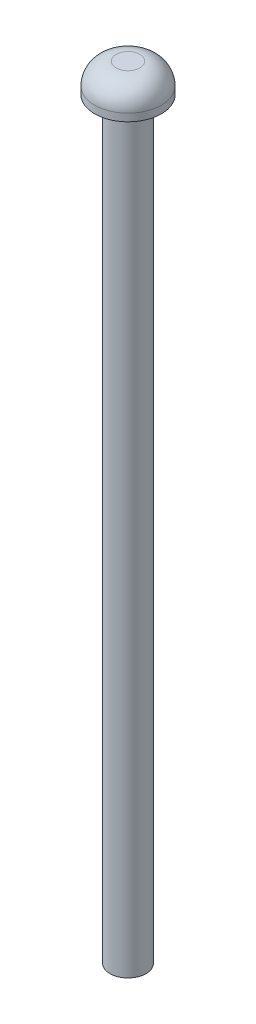
from build123d import *

# Parameters (mm, degrees)
CROQUIS1_R              = 1.675
SALIENTE_EXTRUIR1_DEPTH = 70
CROQUIS2_R              = 3.1
SALIENTE_EXTRUIR2_DEPTH = 2.7
REDONDEO1_R             = 2


with BuildPart() as part:
    # Croquis1 → Saliente-Extruir1 (new body)
    with BuildSketch(Plane(origin=(0, 0, 0), x_dir=(1, 0, 0), z_dir=(0, 1, 0))):
        with Locations(Location((0, 0, 0), (0, 0, 270))):
            Circle(CROQUIS1_R)
    extrude(amount=-SALIENTE_EXTRUIR1_DEPTH)

    # Croquis2 → Saliente-Extruir2 (add)
    with BuildSketch(Plane(origin=(0, 0, 0), x_dir=(1, 0, 0), z_dir=(0, 1, 0))):
        with Locations(Location((0, 0, 0), (0, 0, 90))):
            Circle(CROQUIS2_R)
    extrude(amount=SALIENTE_EXTRUIR2_DEPTH)

    # Redondeo1
    redondeo1_edges = [part.edges().sort_by_distance(p)[0] for p in [
        (0, 2.7, 3.1),
    ]]
    fillet(redondeo1_edges, radius=REDONDEO1_R)


solid = part.part
